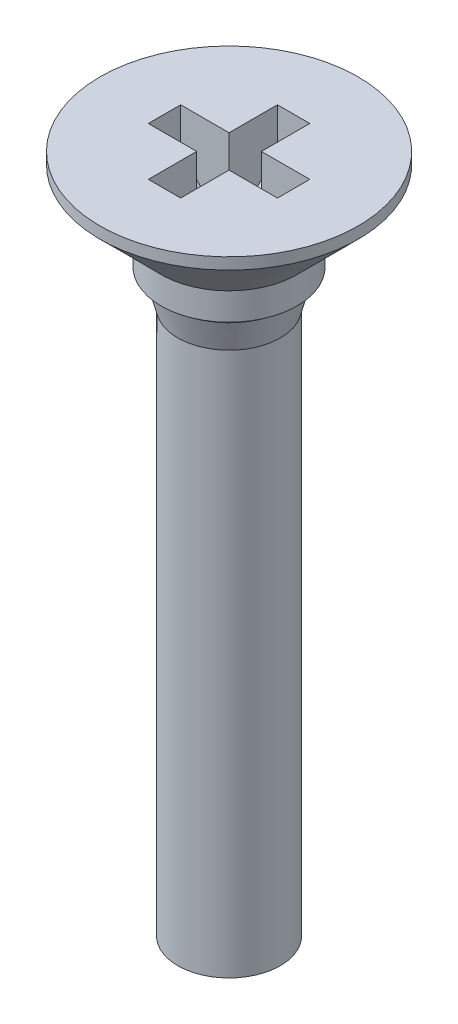
from build123d import *

# Parameters (mm, degrees)
KREUZSCHLITZ1_H_DEPTH      = 0.238
KREUZSCHLITZ1_H_DEPTH_BACK = 0.238
KREUZSCHLITZ2_H_DEPTH      = 0.238
KREUZSCHLITZ2_H_DEPTH_BACK = 0.238


with BuildPart() as part:
    # Skizze1 → Basis-Rotation (revolve)
    with BuildSketch(Plane.XY, mode=Mode.PRIVATE) as basis_rotation_sk:
        Polygon((0, 0), (1.9, 0), (1.9, -0.17), (1, -1.07), (1, -1.47), (0.87, -1.47), (0.87, -1.568948132), (0.7545, -2), (0.7545, -10), (0, -10), align=None)
    revolve(basis_rotation_sk.sketch.rotate(Axis((0, 0, 0), (0, -1, 0)), 180), axis=Axis((0, 0, 0), (0, -1, 0)))

    # Skizze2 → Kreuzschlitz1 H (cut, two sides: drawn at the far end of the back side and taken through both)
    with BuildSketch(Plane.XY.offset(-KREUZSCHLITZ1_H_DEPTH_BACK)):
        Polygon((-0.35, -1.2), (0.35, -1.2), (0.95, -0.6), (0.95, 0), (-0.95, 0), (-0.95, -0.6), align=None)
    extrude(amount=KREUZSCHLITZ1_H_DEPTH + KREUZSCHLITZ1_H_DEPTH_BACK, mode=Mode.SUBTRACT)

    # Skizze3 → Kreuzschlitz2 H (cut, two sides: drawn at the far end of the back side and taken through both)
    with BuildSketch(Plane(origin=(0, 0, 0), x_dir=(0, 0, -1), z_dir=(1, 0, 0)).offset(-KREUZSCHLITZ2_H_DEPTH_BACK)):
        Polygon((-0.35, -1.2), (0.35, -1.2), (0.95, -0.6), (0.95, 0), (-0.95, 0), (-0.95, -0.6), align=None)
    extrude(amount=KREUZSCHLITZ2_H_DEPTH + KREUZSCHLITZ2_H_DEPTH_BACK, mode=Mode.SUBTRACT)


solid = part.part
